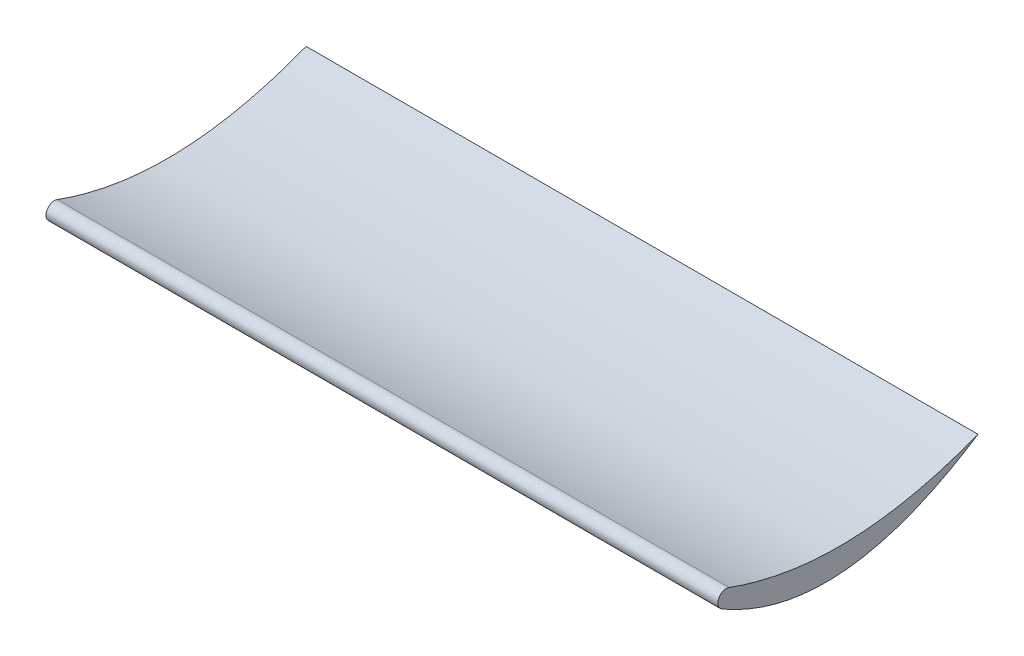
from build123d import *

# Parameters (mm, degrees)
BOSS_EXTRUDE1_DEPTH = 1016
FILLET1_R           = 12.7


with BuildPart() as part:
    # Sketch1 → Boss-Extrude1 (new body)
    with BuildSketch(Plane(origin=(0, 0, 0), x_dir=(0, 0, -1), z_dir=(1, 0, 0))):
        with BuildLine():
            add(Edge.make_bspline(
                [(-228.08835475, 62.624202495), (-11.711824615, -156.977534249), (257.674011594, 20.040320088)],
                knots=[0, 0, 0, 1, 1, 1], degree=2))
            add(Edge.make_bspline(
                [(-228.08835475, 62.624202495), (-4.26268011, -81.75967968), (257.674011594, 20.040320088)],
                knots=[0, 0, 0, 1, 1, 1], degree=2))
        make_face()
    extrude(amount=BOSS_EXTRUDE1_DEPTH)

    # Fillet1
    fillet1_edges = [part.edges().sort_by_distance(p)[0] for p in [
        (508, 62.624202495, 228.08835475),
    ]]
    fillet(fillet1_edges, radius=FILLET1_R)


solid = part.part
